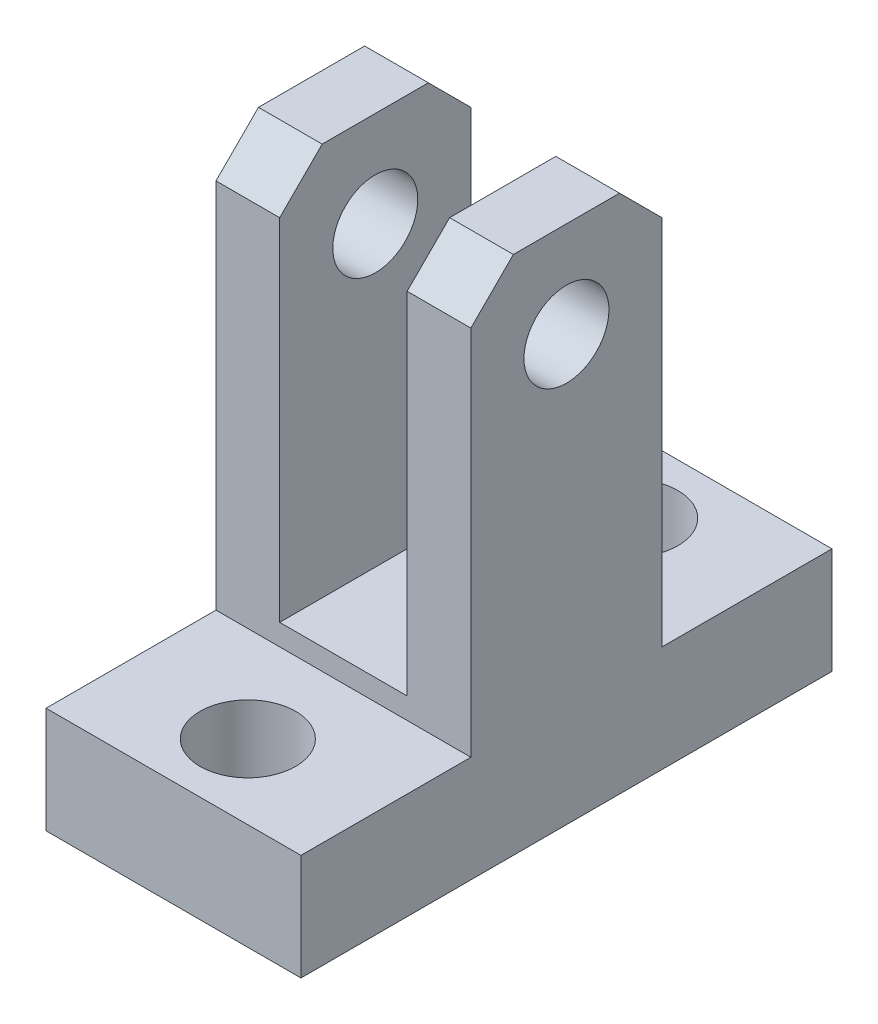
from build123d import *

# Parameters (mm, degrees)
BOSS_EXTRUDE1_DEPTH     = 6
SKETCH2_R               = 2
CUT_EXTRUDE1_DEPTH      = 31.894983412
CHAMFER1_SIZE           = 2
DIAMETER_HOLE1_D        = 4.5
CUT_EXTRUDE2_DEPTH      = 29.151376521
CUT_EXTRUDE2_DEPTH_BACK = 29.151376521
SKETCH5_W               = 6
SKETCH5_H               = 18.5


with BuildPart() as part:
    # Sketch1 → Boss-Extrude1 (new, symmetric)
    with BuildSketch(Plane(origin=(0, 0, 0), x_dir=(0, 0, -1), z_dir=(1, 0, 0))):
        Polygon((-12.5, 0), (12.5, 0), (12.5, 5), (4.5, 5), (4.5, 24.5), (-4.5, 24.5), (-4.5, 5), (-12.5, 5), align=None)
    extrude(amount=BOSS_EXTRUDE1_DEPTH, both=True)

    # Sketch2 → Cut-Extrude1 (cut, through all)
    with BuildSketch(Plane(origin=(6, 0, -2), x_dir=(0, 0, 1), z_dir=(-1, 0, 0))):
        with Locations((2, 20)):
            Circle(SKETCH2_R)
    extrude(amount=CUT_EXTRUDE1_DEPTH, mode=Mode.SUBTRACT)

    # Chamfer1
    chamfer1_edges = [part.edges().sort_by_distance(p)[0] for p in [
        (0, 24.5, 4.5),
        (0, 24.5, -4.5),
    ]]
    chamfer(chamfer1_edges, length=CHAMFER1_SIZE)

    # Diameter Hole1 (through all)
    with Locations(Plane(origin=(5.400260834, 5, -6.193239857), x_dir=(-1, 0, 0), z_dir=(0, 1, 0))):
        with Locations((5.400260834, 15.193239857), (5.400260834, -2.806760143)):
            Hole(DIAMETER_HOLE1_D / 2)

    # Sketch5 → Cut-Extrude2 (cut, two sides: drawn at the far end of the back side and taken through both)
    with BuildSketch(Plane.XY.offset(-CUT_EXTRUDE2_DEPTH_BACK)):
        with Locations((0, 15.25)):
            Rectangle(SKETCH5_W, SKETCH5_H)
    extrude(amount=CUT_EXTRUDE2_DEPTH + CUT_EXTRUDE2_DEPTH_BACK, mode=Mode.SUBTRACT)


solid = part.part
